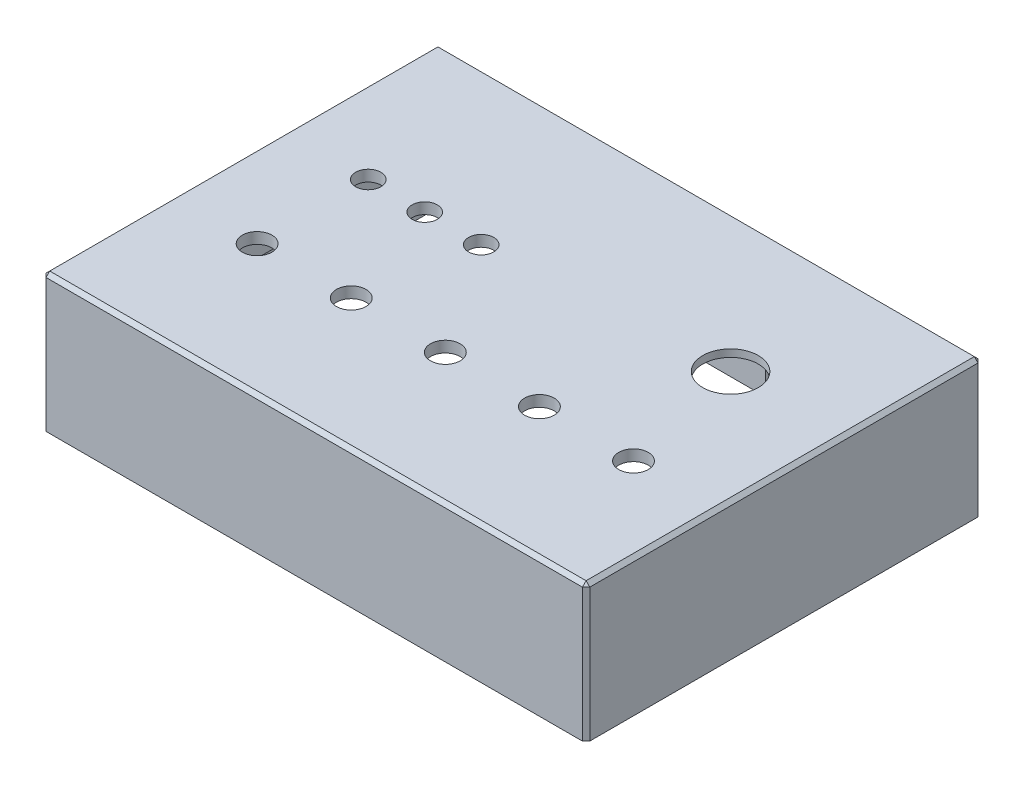
from build123d import *

# Parameters (mm, degrees)
SKETCH_1_W          = 73.4
SKETCH_1_H          = 53.4
SKETCH_1_W_2        = 70.4
SKETCH_1_H_2        = 50.4
EXTRUDE_1_DEPTH     = 17
SKETCH_2_W          = 73.4
SKETCH_2_H          = 53.4
EXTRUDE_2_DEPTH     = 1.5
SKETCH_3_W          = 4.5
SKETCH_3_H          = 4.5
EXTRUDE_3_DEPTH     = 10.5
CUT_EXTRUDE_1_REACH = 50.464
SKETCH_4_R          = 2
SKETCH_4_R_2        = 1.7
SKETCH_4_R_3        = 3.75
SKETCH_5_R          = 1
CUT_EXTRUDE_2_DEPTH = 7
SKETCH_6_W          = 71.8
SKETCH_6_H          = 51.8
CUT_EXTRUDE_3_DEPTH = 7
CHAMFER_1_SIZE      = 0.5
CUT_EXTRUDE_4_REACH = 68.988
SKETCH_9_W          = 11
SKETCH_9_H          = 13
CUT_EXTRUDE_5_DEPTH = 0.5


with BuildPart() as part:
    # Эскиз1 → Бобышка-Вытянуть1 (new body)
    with BuildSketch(Plane(origin=(0, 0, 0), x_dir=(1, 0, 0), z_dir=(0, 1, 0))):
        Rectangle(SKETCH_1_W, SKETCH_1_H)
        Rectangle(SKETCH_1_W_2, SKETCH_1_H_2, mode=Mode.SUBTRACT)
    extrude(amount=-EXTRUDE_1_DEPTH)

    # Эскиз2 → Бобышка-Вытянуть2 (add)
    with BuildSketch(Plane(origin=(0, 0, 0), x_dir=(1, 0, 0), z_dir=(0, 1, 0))):
        Rectangle(SKETCH_2_W, SKETCH_2_H)
    extrude(amount=EXTRUDE_2_DEPTH)

    # Эскиз3 → Бобышка-Вытянуть3 (add)
    with BuildSketch(Plane(origin=(0, 0, 0), x_dir=(1, 0, 0), z_dir=(0, 1, 0))):
        with Locations((-32.95, 22.95)):
            Rectangle(SKETCH_3_W, SKETCH_3_H)
        with Locations((32.95, 22.95)):
            Rectangle(SKETCH_3_W, SKETCH_3_H)
        with Locations((-32.95, -22.95)):
            Rectangle(SKETCH_3_W, SKETCH_3_H)
        with Locations((32.95, -22.95)):
            Rectangle(SKETCH_3_W, SKETCH_3_H)
    extrude(amount=-EXTRUDE_3_DEPTH)

    # Эскиз4 → Вырез-Вытянуть1 (cut, up to next)
    with BuildSketch(Plane(origin=(0, 0, 0), x_dir=(1, 0, 0), z_dir=(0, 1, 0)), mode=Mode.PRIVATE) as cut_extrude_1_sk1:
        with Locations(Location((-25.4, -9, 0), (0, 0, 270))):
            Circle(SKETCH_4_R)
    cut_extrude_1_tool1 = extrude(cut_extrude_1_sk1.sketch, amount=CUT_EXTRUDE_1_REACH, mode=Mode.PRIVATE) & part.part
    # Эскиз4 → Вырез-Вытянуть1 (cut, up to next)
    with BuildSketch(Plane(origin=(0, 0, 0), x_dir=(1, 0, 0), z_dir=(0, 1, 0)), mode=Mode.PRIVATE) as cut_extrude_1_sk2:
        with Locations(Location((-12.7, -9, 0), (0, 0, 270))):
            Circle(SKETCH_4_R)
    cut_extrude_1_tool2 = extrude(cut_extrude_1_sk2.sketch, amount=CUT_EXTRUDE_1_REACH, mode=Mode.PRIVATE) & part.part
    # Эскиз4 → Вырез-Вытянуть1 (cut, up to next)
    with BuildSketch(Plane(origin=(0, 0, 0), x_dir=(1, 0, 0), z_dir=(0, 1, 0)), mode=Mode.PRIVATE) as cut_extrude_1_sk3:
        with Locations(Location((0, -9, 0), (0, 0, 270))):
            Circle(SKETCH_4_R)
    cut_extrude_1_tool3 = extrude(cut_extrude_1_sk3.sketch, amount=CUT_EXTRUDE_1_REACH, mode=Mode.PRIVATE) & part.part
    # Эскиз4 → Вырез-Вытянуть1 (cut, up to next)
    with BuildSketch(Plane(origin=(0, 0, 0), x_dir=(1, 0, 0), z_dir=(0, 1, 0)), mode=Mode.PRIVATE) as cut_extrude_1_sk4:
        with Locations(Location((12.7, -9, 0), (0, 0, 270))):
            Circle(SKETCH_4_R)
    cut_extrude_1_tool4 = extrude(cut_extrude_1_sk4.sketch, amount=CUT_EXTRUDE_1_REACH, mode=Mode.PRIVATE) & part.part
    # Эскиз4 → Вырез-Вытянуть1 (cut, up to next)
    with BuildSketch(Plane(origin=(0, 0, 0), x_dir=(1, 0, 0), z_dir=(0, 1, 0)), mode=Mode.PRIVATE) as cut_extrude_1_sk5:
        with Locations(Location((25.4, -9, 0), (0, 0, 270))):
            Circle(SKETCH_4_R)
    cut_extrude_1_tool5 = extrude(cut_extrude_1_sk5.sketch, amount=CUT_EXTRUDE_1_REACH, mode=Mode.PRIVATE) & part.part
    # Эскиз4 → Вырез-Вытянуть1 (cut, up to next)
    with BuildSketch(Plane(origin=(0, 0, 0), x_dir=(1, 0, 0), z_dir=(0, 1, 0)), mode=Mode.PRIVATE) as cut_extrude_1_sk6:
        with Locations(Location((-25.4, 6, 0), (0, 0, 270))):
            Circle(SKETCH_4_R_2)
    cut_extrude_1_tool6 = extrude(cut_extrude_1_sk6.sketch, amount=CUT_EXTRUDE_1_REACH, mode=Mode.PRIVATE) & part.part
    # Эскиз4 → Вырез-Вытянуть1 (cut, up to next)
    with BuildSketch(Plane(origin=(0, 0, 0), x_dir=(1, 0, 0), z_dir=(0, 1, 0)), mode=Mode.PRIVATE) as cut_extrude_1_sk7:
        with Locations(Location((-17.78, 6, 0), (0, 0, 270))):
            Circle(SKETCH_4_R_2)
    cut_extrude_1_tool7 = extrude(cut_extrude_1_sk7.sketch, amount=CUT_EXTRUDE_1_REACH, mode=Mode.PRIVATE) & part.part
    # Эскиз4 → Вырез-Вытянуть1 (cut, up to next)
    with BuildSketch(Plane(origin=(0, 0, 0), x_dir=(1, 0, 0), z_dir=(0, 1, 0)), mode=Mode.PRIVATE) as cut_extrude_1_sk8:
        with Locations(Location((-10.16, 6, 0), (0, 0, 270))):
            Circle(SKETCH_4_R_2)
    cut_extrude_1_tool8 = extrude(cut_extrude_1_sk8.sketch, amount=CUT_EXTRUDE_1_REACH, mode=Mode.PRIVATE) & part.part
    # Эскиз4 → Вырез-Вытянуть1 (cut, up to next)
    with BuildSketch(Plane(origin=(0, 0, 0), x_dir=(1, 0, 0), z_dir=(0, 1, 0)), mode=Mode.PRIVATE) as cut_extrude_1_sk9:
        with Locations(Location((21.5, 8, 0), (0, 0, 270))):
            Circle(SKETCH_4_R_3)
    cut_extrude_1_tool9 = extrude(cut_extrude_1_sk9.sketch, amount=CUT_EXTRUDE_1_REACH, mode=Mode.PRIVATE) & part.part
    add(cut_extrude_1_tool1.solids().sort_by_distance((-25.4, 0, 9))[0], mode=Mode.SUBTRACT)
    add(cut_extrude_1_tool2.solids().sort_by_distance((-12.7, 0, 9))[0], mode=Mode.SUBTRACT)
    add(cut_extrude_1_tool3.solids().sort_by_distance((0, 0, 9))[0], mode=Mode.SUBTRACT)
    add(cut_extrude_1_tool4.solids().sort_by_distance((12.7, 0, 9))[0], mode=Mode.SUBTRACT)
    add(cut_extrude_1_tool5.solids().sort_by_distance((25.4, 0, 9))[0], mode=Mode.SUBTRACT)
    add(cut_extrude_1_tool6.solids().sort_by_distance((-25.4, 0, -6))[0], mode=Mode.SUBTRACT)
    add(cut_extrude_1_tool7.solids().sort_by_distance((-17.78, 0, -6))[0], mode=Mode.SUBTRACT)
    add(cut_extrude_1_tool8.solids().sort_by_distance((-10.16, 0, -6))[0], mode=Mode.SUBTRACT)
    add(cut_extrude_1_tool9.solids().sort_by_distance((21.5, 0, -8))[0], mode=Mode.SUBTRACT)

    # Эскиз5 → Вырез-Вытянуть2 (cut)
    with BuildSketch(Plane.XZ.offset(10.5)):
        with Locations(Location((-33, 23, 0), (0, 0, 270))):
            Circle(SKETCH_5_R)
        with Locations(Location((33, 23, 0), (0, 0, 90))):
            Circle(SKETCH_5_R)
        with Locations(Location((33, -23, 0), (0, 0, 270))):
            Circle(SKETCH_5_R)
        with Locations(Location((-33, -23, 0), (0, 0, 90))):
            Circle(SKETCH_5_R)
    extrude(amount=-CUT_EXTRUDE_2_DEPTH, mode=Mode.SUBTRACT)

    # Эскиз6 → Вырез-Вытянуть3 (cut)
    with BuildSketch(Plane.XZ.offset(17)):
        Rectangle(SKETCH_6_W, SKETCH_6_H)
    extrude(amount=-CUT_EXTRUDE_3_DEPTH, mode=Mode.SUBTRACT)

    # Фаска1
    chamfer_1_edges = [part.edges().sort_by_distance(p)[0] for p in [
        (-36.7, 1.5, 0),
        (0, 1.5, 26.7),
        (36.7, 1.5, 0),
        (0, 1.5, -26.7),
        (-36.7, -7.75, -26.7),
        (36.7, -7.75, -26.7),
        (36.7, -7.75, 26.7),
        (-36.7, -7.75, 26.7),
    ]]
    chamfer(chamfer_1_edges, length=CHAMFER_1_SIZE)

    # Эскиз7 → Вырез-Вытянуть4 (cut, up to next)
    with BuildSketch(Plane(origin=(0, 0, -26.7), x_dir=(-1, 0, 0), z_dir=(0, 0, -1)), mode=Mode.PRIVATE) as cut_extrude_4_sk1:
        with BuildLine():
            Line((-8.3, -13.8), (-8.3, -17))
            Line((-8.3, -17), (-14.7, -17))
            Line((-14.7, -17), (-14.7, -13.8))
            ThreePointArc((-14.7, -13.8), (-11.5, -10.6), (-8.3, -13.8))
        make_face()
    cut_extrude_4_tool1 = extrude(cut_extrude_4_sk1.sketch, amount=-CUT_EXTRUDE_4_REACH, mode=Mode.PRIVATE) & part.part
    # Эскиз7 → Вырез-Вытянуть4 (cut, up to next)
    with BuildSketch(Plane(origin=(0, 0, -26.7), x_dir=(-1, 0, 0), z_dir=(0, 0, -1)), mode=Mode.PRIVATE) as cut_extrude_4_sk2:
        with BuildLine():
            Line((22.2, -13.8), (22.2, -17))
            Line((22.2, -17), (15.8, -17))
            Line((15.8, -17), (15.8, -13.8))
            ThreePointArc((15.8, -13.8), (19, -10.6), (22.2, -13.8))
        make_face()
    cut_extrude_4_tool2 = extrude(cut_extrude_4_sk2.sketch, amount=-CUT_EXTRUDE_4_REACH, mode=Mode.PRIVATE) & part.part
    add(cut_extrude_4_tool1.solids().sort_by_distance((11.5, -14.09872, -26.7))[0], mode=Mode.SUBTRACT)
    add(cut_extrude_4_tool2.solids().sort_by_distance((-19, -14.09872, -26.7))[0], mode=Mode.SUBTRACT)

    # Эскиз9 → Вырез-Вытянуть5 (cut)
    with BuildSketch(Plane(origin=(0, 0, 0), x_dir=(1, 0, 0), z_dir=(0, 1, 0))):
        with Locations((21.5, 8)):
            Rectangle(SKETCH_9_W, SKETCH_9_H)
    extrude(amount=CUT_EXTRUDE_5_DEPTH, mode=Mode.SUBTRACT)


solid = part.part
